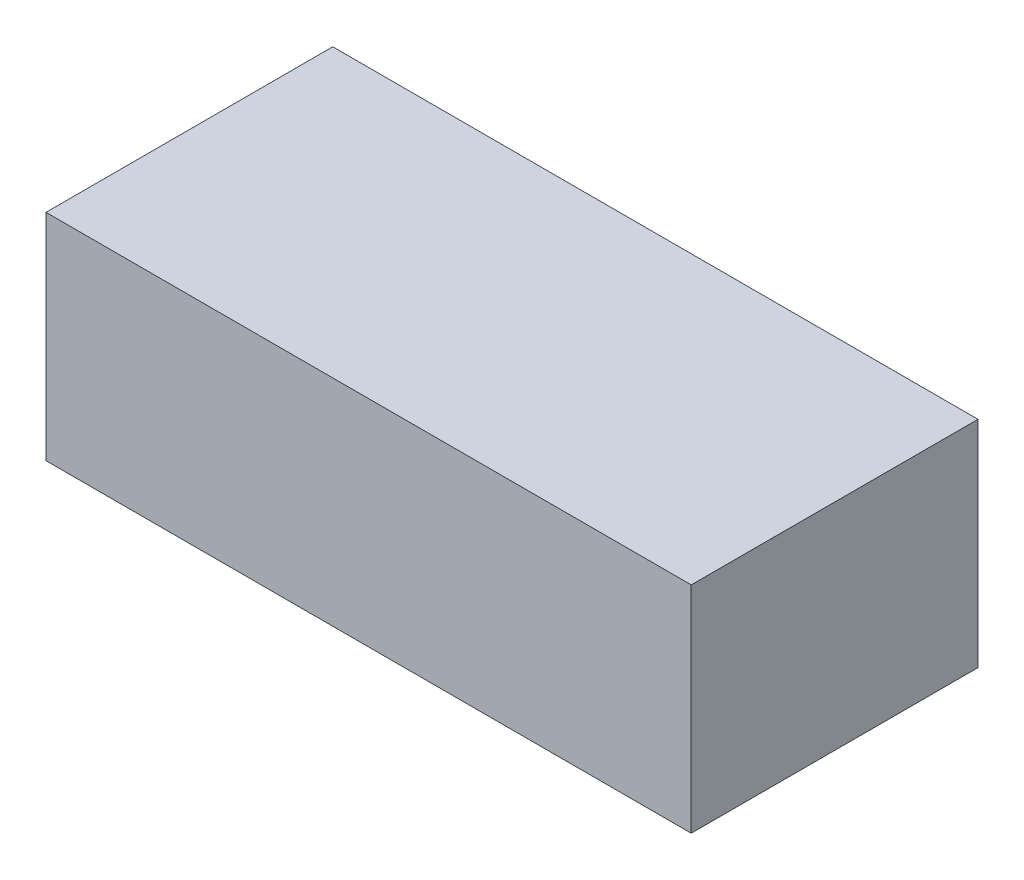
from build123d import *

# Parameters (mm, degrees)
SKETCH1_W           = 1800
SKETCH1_H           = 800
BOSS_EXTRUDE1_DEPTH = 600


with BuildPart() as part:
    # Sketch1 → Boss-Extrude1 (new body)
    with BuildSketch(Plane(origin=(0, 0, 0), x_dir=(1, 0, 0), z_dir=(0, 1, 0))):
        with Locations((123.387096774, -131.451612903)):
            Rectangle(SKETCH1_W, SKETCH1_H)
    extrude(amount=BOSS_EXTRUDE1_DEPTH)


solid = part.part
